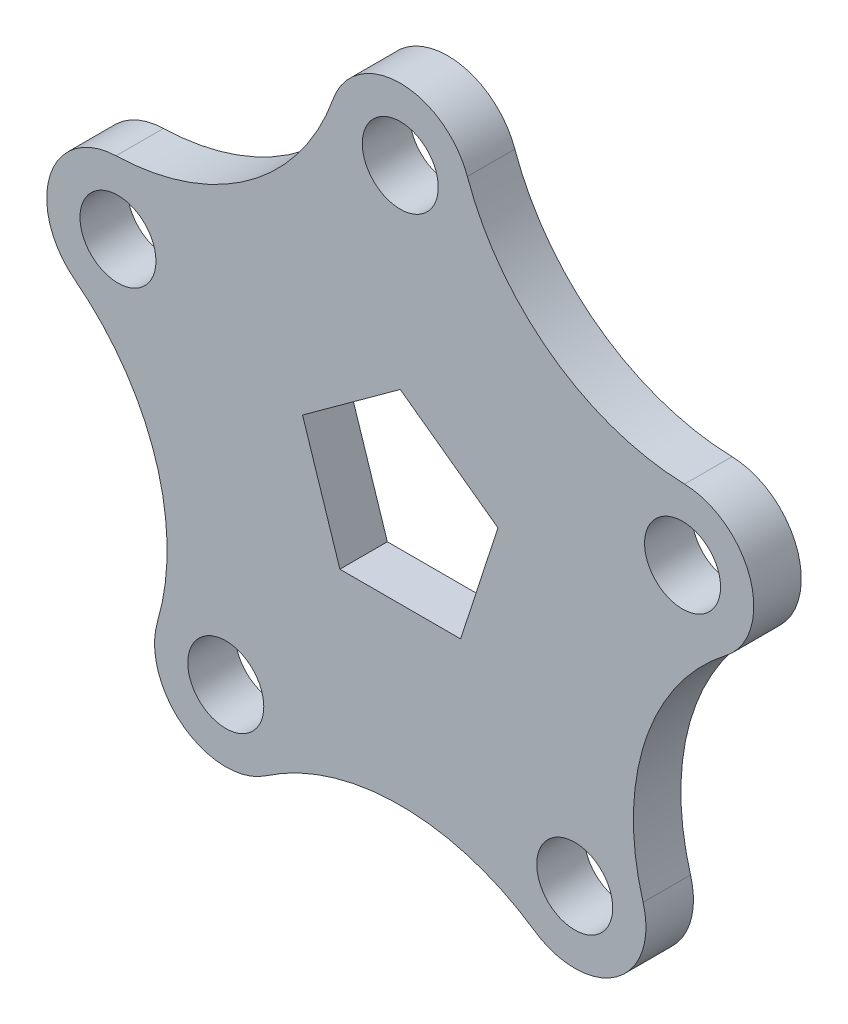
from build123d import *

# Parameters (mm, degrees)
SKETCH1_R           = 8
BOSS_EXTRUDE1_DEPTH = 10


with BuildPart() as part:
    # Sketch1 → Boss-Extrude1 (new body)
    # profile 1 of 2: a face of its own
    with BuildSketch(Plane.XY):
        with BuildLine():
            ThreePointArc((59.85601991, 34.307820558), (31.850049433, 43.837832205), (14.132148934, 67.528157367))
            ThreePointArc((14.132148934, 67.528157367), (0, 77.5), (-14.132148934, 67.528157367))
            ThreePointArc((-14.132148934, 67.528157367), (-31.850049433, 43.837832205), (-59.85601991, 34.307820558))
            ThreePointArc((-59.85601991, 34.307820558), (-73.706880013, 23.948817064), (-68.590168285, 7.426875892))
            ThreePointArc((-68.590168285, 7.426875892), (-51.534462525, -16.744561909), (-51.125203669, -46.324758182))
            ThreePointArc((-51.125203669, -46.324758182), (-45.553357053, -62.698817064), (-28.25890636, -62.938095635))
            ThreePointArc((-28.25890636, -62.938095635), (0, -54.186540592), (28.25890636, -62.938095635))
            ThreePointArc((28.25890636, -62.938095635), (45.553357053, -62.698817064), (51.125203669, -46.324758182))
            ThreePointArc((51.125203669, -46.324758182), (51.534462525, -16.744561909), (68.590168285, 7.426875892))
            ThreePointArc((68.590168285, 7.426875892), (45.175184524, 14.678307233), (59.85601991, 34.307820558))
        make_face()
        with Locations((-36.736578268, -50.563562148)):
            Circle(SKETCH1_R, mode=Mode.SUBTRACT)
        Polygon((-20.57248383, 6.684405197), (0, 21.631189606), (20.57248383, 6.684405197), (12.71449424, -17.5), (-12.71449424, -17.5), align=None, mode=Mode.SUBTRACT)
        with Locations((36.736578268, -50.563562148)):
            Circle(SKETCH1_R, mode=Mode.SUBTRACT)
        with Locations((-59.441032268, 19.313562148)):
            Circle(SKETCH1_R, mode=Mode.SUBTRACT)
        with Locations((0, 62.5)):
            Circle(SKETCH1_R, mode=Mode.SUBTRACT)
    # profile 2 of 2: a face of its own
    with BuildSketch(Plane.XY):
        with BuildLine():
            ThreePointArc((74.441032268, 19.313562148), (70.193353288, 29.772414509), (59.85601991, 34.307820558))
            ThreePointArc((59.85601991, 34.307820558), (45.175184524, 14.678307233), (68.590168285, 7.426875892))
            ThreePointArc((68.590168285, 7.426875892), (72.89906036, 12.689252382), (74.441032268, 19.313562148))
        make_face()
        with Locations((59.441032268, 19.313562148)):
            Circle(SKETCH1_R, mode=Mode.SUBTRACT)
    extrude(amount=BOSS_EXTRUDE1_DEPTH)


solid = part.part
